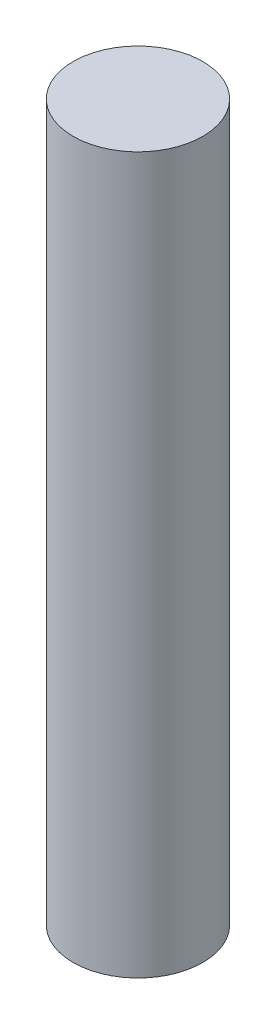
from build123d import *

# Parameters (mm, degrees)
BOSS_EXTRUDE1_START = -2050
SKETCH1_R           = 371.577196406
BOSS_EXTRUDE1_DEPTH = 4100


with BuildPart() as part:
    # Sketch1 → Boss-Extrude1 (new body)
    with BuildSketch(Plane(origin=(0, 0, 0), x_dir=(1, 0, 0), z_dir=(0, 1, 0)).offset(BOSS_EXTRUDE1_START)):
        with Locations(Location((1299.28989768, 0, 0), (0, 0, 270))):
            Circle(SKETCH1_R)
    extrude(amount=BOSS_EXTRUDE1_DEPTH)


solid = part.part
